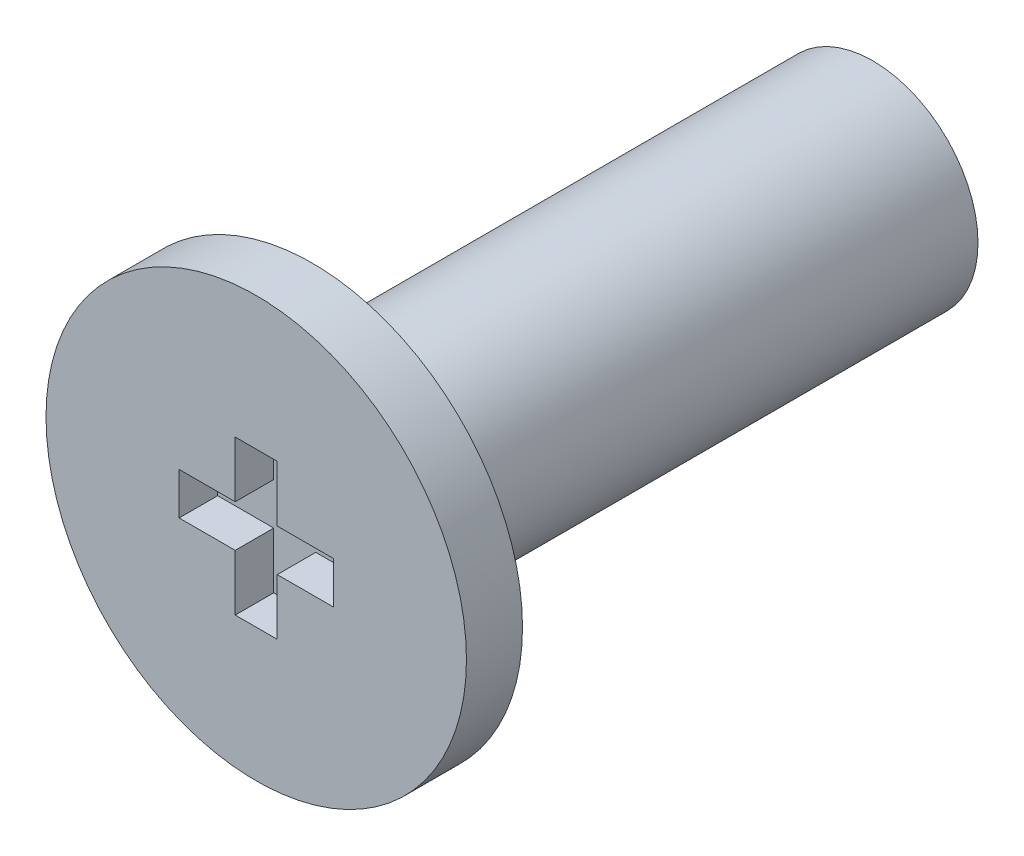
from build123d import *

# Parameters (mm, degrees)
SKETCH_1_R        = 1.5
EXTRUDE_198_DEPTH = 8
SKETCH_6_W        = 3
SKETCH_6_H        = 0.8
PH1_START         = 0.81
PH1_DEPTH         = 0.56


with BuildPart() as part:
    # 草图1 → Extrude 198 (new body)
    with BuildSketch(Plane.XY):
        Circle(SKETCH_1_R)
    extrude(amount=-EXTRUDE_198_DEPTH)

    # 草图6 → Revolve 324 (revolve)
    with BuildSketch(Plane(origin=(0, 0, 0), x_dir=(1, 0, 0), z_dir=(0, 1, 0)), mode=Mode.PRIVATE) as revolve_324_sk:
        with Locations((1.5, -0.4)):
            Rectangle(SKETCH_6_W, SKETCH_6_H)
    revolve(revolve_324_sk.sketch.rotate(Axis((0, 0, -2), (0, 0, 1)), 180), axis=Axis((0, 0, -2), (0, 0, 1)))

    # 草图7 → 十字槽_PH1_简化 (cut)
    with BuildSketch(Plane.XY.offset(PH1_START)):
        Polygon((-0.3, -1.1), (0.3, -1.1), (0.3, -0.3), (1.1, -0.3), (1.1, 0.3), (0.3, 0.3), (0.3, 1.1), (-0.3, 1.1), (-0.3, 0.3), (-1.1, 0.3), (-1.1, -0.3), (-0.3, -0.3), align=None)
    extrude(amount=-PH1_DEPTH, mode=Mode.SUBTRACT)


solid = part.part
